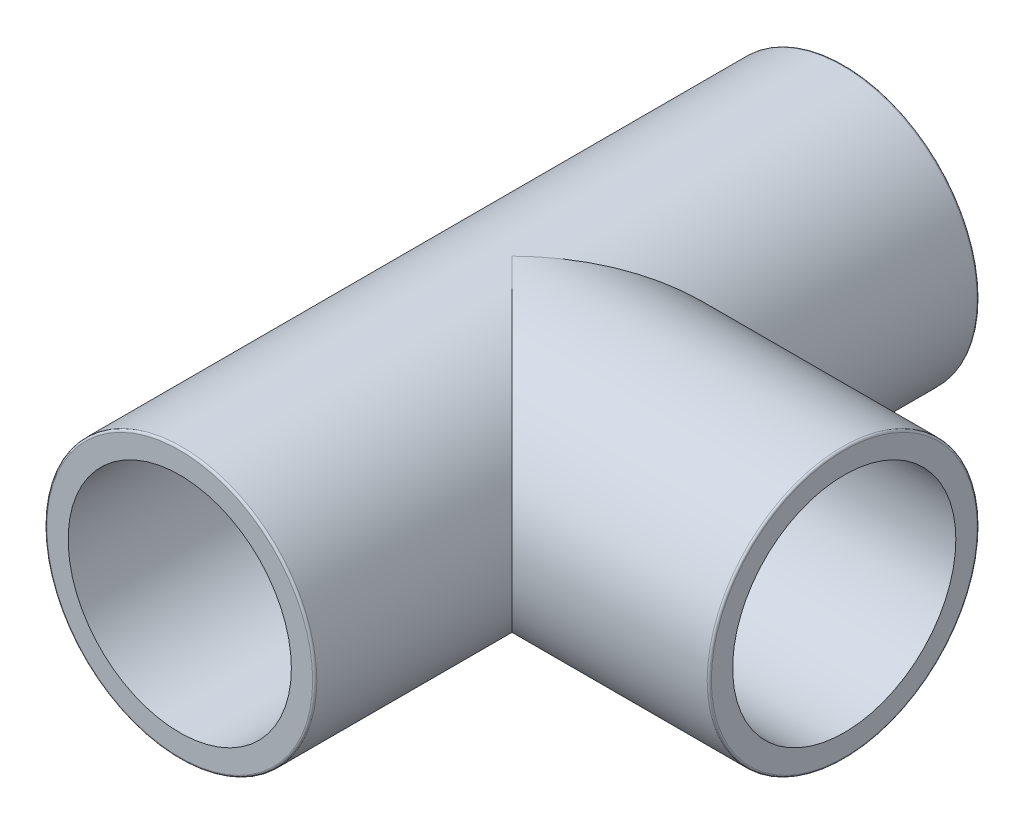
from build123d import *

# Parameters (mm, degrees)
SKETCH2_R           = 13
SKETCH2_R_2         = 10.25
BOSS_EXTRUDE1_DEPTH = 64
SKETCH3_R           = 13
BOSS_EXTRUDE2_DEPTH = 32
SKETCH4_R           = 10.25
CUT_EXTRUDE1_DEPTH  = 32
SKETCH5_R           = 10.25
CUT_EXTRUDE2_DEPTH  = 78
SKETCH6_R           = 10.75
CUT_EXTRUDE3_DEPTH  = 20
CUT_EXTRUDE4_START  = -20
SKETCH7_R           = 10.75
CUT_EXTRUDE4_DEPTH  = 20
SKETCH8_R           = 10.75
CUT_EXTRUDE5_DEPTH  = 20
FILLET1_R           = 0.2


with BuildPart() as part:
    # Sketch2 → Boss-Extrude1 (new body)
    with BuildSketch(Plane.XY):
        Circle(SKETCH2_R)
        Circle(SKETCH2_R_2, mode=Mode.SUBTRACT)
    extrude(amount=-BOSS_EXTRUDE1_DEPTH)

    # Sketch3 → Boss-Extrude2 (add)
    with BuildSketch(Plane(origin=(32, 0, 0), x_dir=(0, 0, -1), z_dir=(1, 0, 0))):
        with Locations((32, 0)):
            Circle(SKETCH3_R)
    extrude(amount=-BOSS_EXTRUDE2_DEPTH)

    # Sketch4 → Cut-Extrude1 (cut)
    with BuildSketch(Plane(origin=(32, 0, 0), x_dir=(0, 0, -1), z_dir=(1, 0, 0))):
        with Locations((32, 0)):
            Circle(SKETCH4_R)
    extrude(amount=-CUT_EXTRUDE1_DEPTH, mode=Mode.SUBTRACT)

    # Sketch5 → Cut-Extrude2 (cut)
    with BuildSketch(Plane.XY):
        Circle(SKETCH5_R)
    extrude(amount=-CUT_EXTRUDE2_DEPTH, mode=Mode.SUBTRACT)

    # Sketch6 → Cut-Extrude3 (cut)
    with BuildSketch(Plane.XY):
        Circle(SKETCH6_R)
    extrude(amount=-CUT_EXTRUDE3_DEPTH, mode=Mode.SUBTRACT)

    # Sketch7 → Cut-Extrude4 (cut)
    with BuildSketch(Plane(origin=(0, 0, -64), x_dir=(-1, 0, 0), z_dir=(0, 0, -1)).offset(CUT_EXTRUDE4_START)):
        with Locations(Location((0, 0, 0), (0, 0, 180))):
            Circle(SKETCH7_R)
    extrude(amount=CUT_EXTRUDE4_DEPTH, mode=Mode.SUBTRACT)

    # Sketch8 → Cut-Extrude5 (cut)
    with BuildSketch(Plane(origin=(32, 0, 0), x_dir=(0, 0, -1), z_dir=(1, 0, 0))):
        with Locations((32, 0)):
            Circle(SKETCH8_R)
    extrude(amount=-CUT_EXTRUDE5_DEPTH, mode=Mode.SUBTRACT)

    # Fillet1
    fillet1_edges = [part.edges().sort_by_distance(p)[0] for p in [
        (32, 0, -19),
        (-13, 0, 0),
        (-13, 0, -64),
    ]]
    fillet(fillet1_edges, radius=FILLET1_R)


solid = part.part
